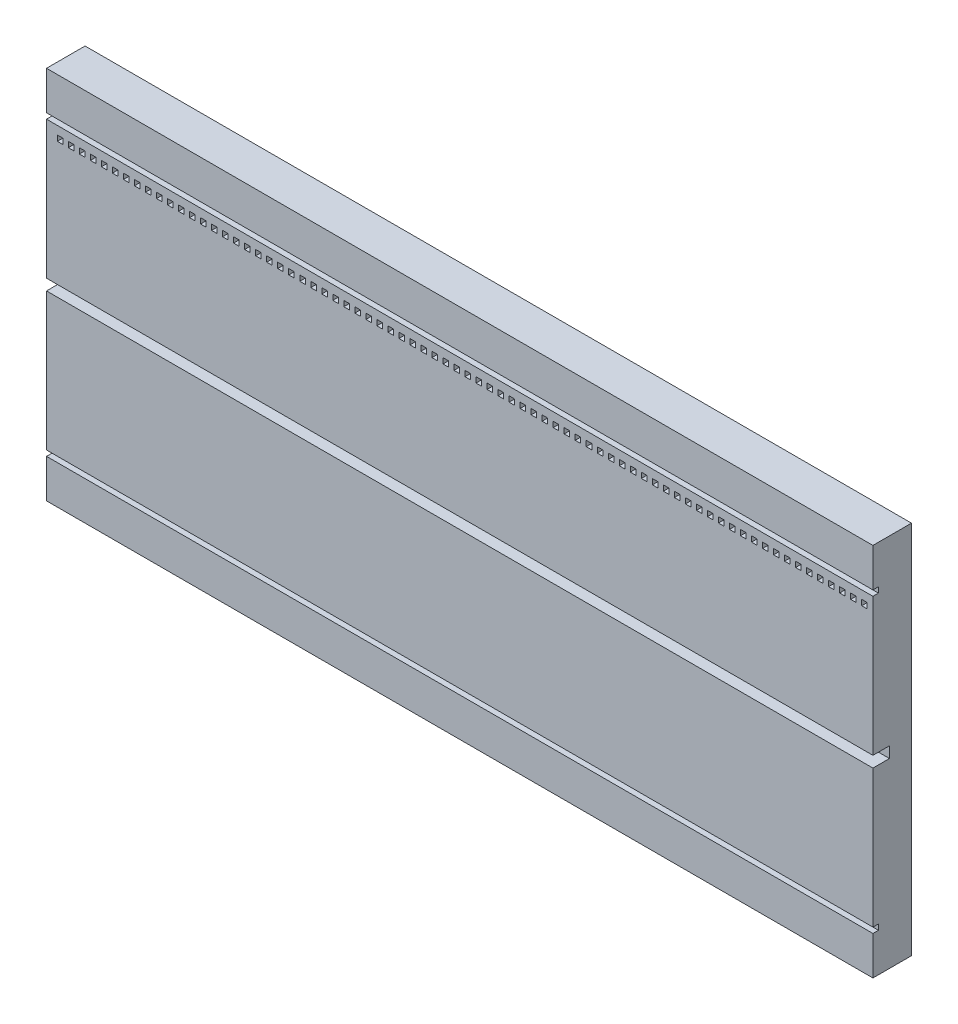
from build123d import *

# Parameters (mm, degrees)
IZIM1_W                     = 150
IZIM1_H                     = 68
Y_KSEKLIK_EKSTR_ZYON1_DEPTH = 7
IZIM2_W                     = 150
IZIM2_H                     = 1
KES_EKSTR_ZYON1_DEPTH       = 1
IZIM3_W                     = 150
IZIM3_H                     = 1
KES_EKSTR_ZYON2_DEPTH       = 1
IZIM4_W                     = 150
IZIM4_H                     = 2
KES_EKSTR_ZYON5_DEPTH       = 3
IZIM5_W                     = 1
IZIM5_H                     = 1
KES_EKSTR_ZYON6_DEPTH       = 1


with BuildPart() as part:
    # Çizim1 → Yükseklik-Ekstrüzyon1 (new body)
    with BuildSketch(Plane.XY):
        Rectangle(IZIM1_W, IZIM1_H)
    extrude(amount=Y_KSEKLIK_EKSTR_ZYON1_DEPTH)

    # Çizim2 → Kes-Ekstrüzyon1 (cut)
    with BuildSketch(Plane.XY.offset(7)):
        with Locations((0, 26.5)):
            Rectangle(IZIM2_W, IZIM2_H)
    extrude(amount=-KES_EKSTR_ZYON1_DEPTH, mode=Mode.SUBTRACT)

    # Çizim3 → Kes-Ekstrüzyon2 (cut)
    with BuildSketch(Plane.XY.offset(7)):
        with Locations((0, -26.5)):
            Rectangle(IZIM3_W, IZIM3_H)
    extrude(amount=-KES_EKSTR_ZYON2_DEPTH, mode=Mode.SUBTRACT)

    # Çizim4 → Kes-Ekstrüzyon5 (cut)
    with BuildSketch(Plane.XY.offset(7)):
        Rectangle(IZIM4_W, IZIM4_H)
    extrude(amount=-KES_EKSTR_ZYON5_DEPTH, mode=Mode.SUBTRACT)

    # Çizim5 → Kes-Ekstrüzyon6 (cut)
    with BuildSketch(Plane.XY.offset(7)):
        with Locations((73.465936292, 24)):
            Rectangle(IZIM5_W, IZIM5_H)
        with Locations((71.465936292, 24)):
            Rectangle(IZIM5_W, IZIM5_H)
        with Locations((69.465936292, 24)):
            Rectangle(IZIM5_W, IZIM5_H)
        with Locations((67.465936292, 24)):
            Rectangle(IZIM5_W, IZIM5_H)
        with Locations((65.465936292, 24)):
            Rectangle(IZIM5_W, IZIM5_H)
        with Locations((63.465936292, 24)):
            Rectangle(IZIM5_W, IZIM5_H)
        with Locations((61.465936292, 24)):
            Rectangle(IZIM5_W, IZIM5_H)
        with Locations((59.465936292, 24)):
            Rectangle(IZIM5_W, IZIM5_H)
        with Locations((57.465936292, 24)):
            Rectangle(IZIM5_W, IZIM5_H)
        with Locations((55.465936292, 24)):
            Rectangle(IZIM5_W, IZIM5_H)
        with Locations((53.465936292, 24)):
            Rectangle(IZIM5_W, IZIM5_H)
        with Locations((51.465936292, 24)):
            Rectangle(IZIM5_W, IZIM5_H)
        with Locations((49.465936292, 24)):
            Rectangle(IZIM5_W, IZIM5_H)
        with Locations((47.465936292, 24)):
            Rectangle(IZIM5_W, IZIM5_H)
        with Locations((45.465936292, 24)):
            Rectangle(IZIM5_W, IZIM5_H)
        with Locations((43.465936292, 24)):
            Rectangle(IZIM5_W, IZIM5_H)
        with Locations((41.465936292, 24)):
            Rectangle(IZIM5_W, IZIM5_H)
        with Locations((39.465936292, 24)):
            Rectangle(IZIM5_W, IZIM5_H)
        with Locations((37.465936292, 24)):
            Rectangle(IZIM5_W, IZIM5_H)
        with Locations((35.465936292, 24)):
            Rectangle(IZIM5_W, IZIM5_H)
        with Locations((33.465936292, 24)):
            Rectangle(IZIM5_W, IZIM5_H)
        with Locations((31.465936292, 24)):
            Rectangle(IZIM5_W, IZIM5_H)
        with Locations((29.465936292, 24)):
            Rectangle(IZIM5_W, IZIM5_H)
        with Locations((27.465936292, 24)):
            Rectangle(IZIM5_W, IZIM5_H)
        with Locations((25.465936292, 24)):
            Rectangle(IZIM5_W, IZIM5_H)
        with Locations((23.465936292, 24)):
            Rectangle(IZIM5_W, IZIM5_H)
        with Locations((21.465936292, 24)):
            Rectangle(IZIM5_W, IZIM5_H)
        with Locations((19.465936292, 24)):
            Rectangle(IZIM5_W, IZIM5_H)
        with Locations((17.465936292, 24)):
            Rectangle(IZIM5_W, IZIM5_H)
        with Locations((15.465936292, 24)):
            Rectangle(IZIM5_W, IZIM5_H)
        with Locations((13.465936292, 24)):
            Rectangle(IZIM5_W, IZIM5_H)
        with Locations((11.465936292, 24)):
            Rectangle(IZIM5_W, IZIM5_H)
        with Locations((9.465936292, 24)):
            Rectangle(IZIM5_W, IZIM5_H)
        with Locations((7.465936292, 24)):
            Rectangle(IZIM5_W, IZIM5_H)
        with Locations((5.465936292, 24)):
            Rectangle(IZIM5_W, IZIM5_H)
        with Locations((3.465936292, 24)):
            Rectangle(IZIM5_W, IZIM5_H)
        with Locations((1.465936292, 24)):
            Rectangle(IZIM5_W, IZIM5_H)
        with Locations((-0.534063708, 24)):
            Rectangle(IZIM5_W, IZIM5_H)
        with Locations((-2.534063708, 24)):
            Rectangle(IZIM5_W, IZIM5_H)
        with Locations((-4.534063708, 24)):
            Rectangle(IZIM5_W, IZIM5_H)
        with Locations((-6.534063708, 24)):
            Rectangle(IZIM5_W, IZIM5_H)
        with Locations((-8.534063708, 24)):
            Rectangle(IZIM5_W, IZIM5_H)
        with Locations((-10.534063708, 24)):
            Rectangle(IZIM5_W, IZIM5_H)
        with Locations((-12.534063708, 24)):
            Rectangle(IZIM5_W, IZIM5_H)
        with Locations((-14.534063708, 24)):
            Rectangle(IZIM5_W, IZIM5_H)
        with Locations((-16.534063708, 24)):
            Rectangle(IZIM5_W, IZIM5_H)
        with Locations((-18.534063708, 24)):
            Rectangle(IZIM5_W, IZIM5_H)
        with Locations((-20.534063708, 24)):
            Rectangle(IZIM5_W, IZIM5_H)
        with Locations((-22.534063708, 24)):
            Rectangle(IZIM5_W, IZIM5_H)
        with Locations((-24.534063708, 24)):
            Rectangle(IZIM5_W, IZIM5_H)
        with Locations((-26.534063708, 24)):
            Rectangle(IZIM5_W, IZIM5_H)
        with Locations((-28.534063708, 24)):
            Rectangle(IZIM5_W, IZIM5_H)
        with Locations((-30.534063708, 24)):
            Rectangle(IZIM5_W, IZIM5_H)
        with Locations((-32.534063708, 24)):
            Rectangle(IZIM5_W, IZIM5_H)
        with Locations((-34.534063708, 24)):
            Rectangle(IZIM5_W, IZIM5_H)
        with Locations((-36.534063708, 24)):
            Rectangle(IZIM5_W, IZIM5_H)
        with Locations((-38.534063708, 24)):
            Rectangle(IZIM5_W, IZIM5_H)
        with Locations((-40.534063708, 24)):
            Rectangle(IZIM5_W, IZIM5_H)
        with Locations((-42.534063708, 24)):
            Rectangle(IZIM5_W, IZIM5_H)
        with Locations((-44.534063708, 24)):
            Rectangle(IZIM5_W, IZIM5_H)
        with Locations((-46.534063708, 24)):
            Rectangle(IZIM5_W, IZIM5_H)
        with Locations((-48.534063708, 24)):
            Rectangle(IZIM5_W, IZIM5_H)
        with Locations((-50.534063708, 24)):
            Rectangle(IZIM5_W, IZIM5_H)
        with Locations((-52.534063708, 24)):
            Rectangle(IZIM5_W, IZIM5_H)
        with Locations((-54.534063708, 24)):
            Rectangle(IZIM5_W, IZIM5_H)
        with Locations((-56.534063708, 24)):
            Rectangle(IZIM5_W, IZIM5_H)
        with Locations((-58.534063708, 24)):
            Rectangle(IZIM5_W, IZIM5_H)
        with Locations((-60.534063708, 24)):
            Rectangle(IZIM5_W, IZIM5_H)
        with Locations((-62.534063708, 24)):
            Rectangle(IZIM5_W, IZIM5_H)
        with Locations((-64.534063708, 24)):
            Rectangle(IZIM5_W, IZIM5_H)
        with Locations((-66.534063708, 24)):
            Rectangle(IZIM5_W, IZIM5_H)
        with Locations((-68.534063708, 24)):
            Rectangle(IZIM5_W, IZIM5_H)
        with Locations((-70.534063708, 24)):
            Rectangle(IZIM5_W, IZIM5_H)
        with Locations((-72.534063708, 24)):
            Rectangle(IZIM5_W, IZIM5_H)
    extrude(amount=-KES_EKSTR_ZYON6_DEPTH, mode=Mode.SUBTRACT)


solid = part.part
